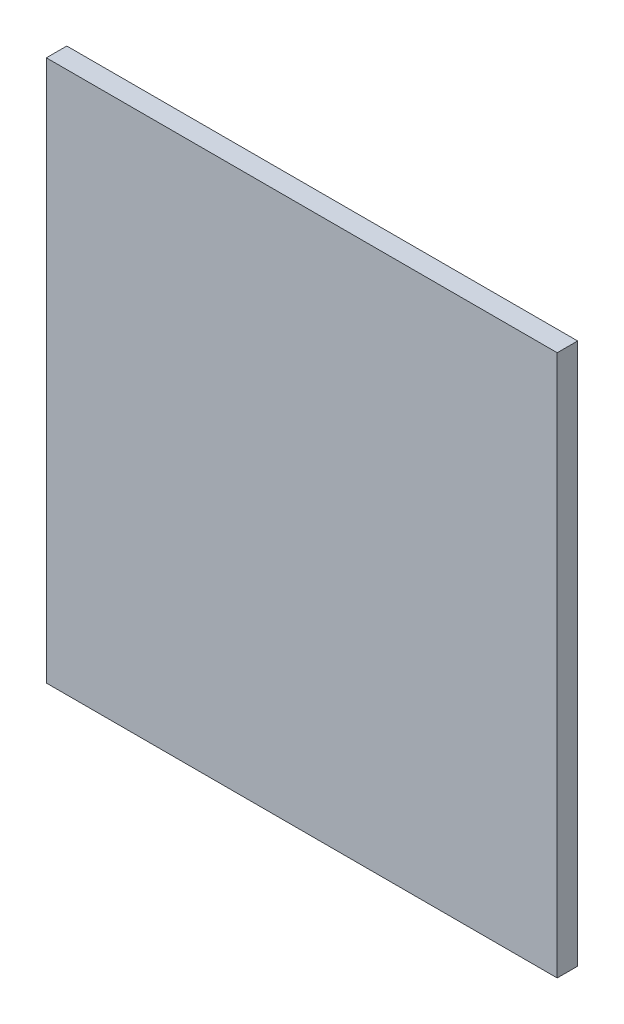
from build123d import *

# Parameters (mm, degrees)
ESQUISSE1_W        = 500
ESQUISSE1_H        = 530
BOSS_EXTRU_1_DEPTH = 20


with BuildPart() as part:
    # Esquisse1 → Boss.-Extru.1 (new body)
    with BuildSketch(Plane.XY):
        Rectangle(ESQUISSE1_W, ESQUISSE1_H)
    extrude(amount=BOSS_EXTRU_1_DEPTH)


solid = part.part
